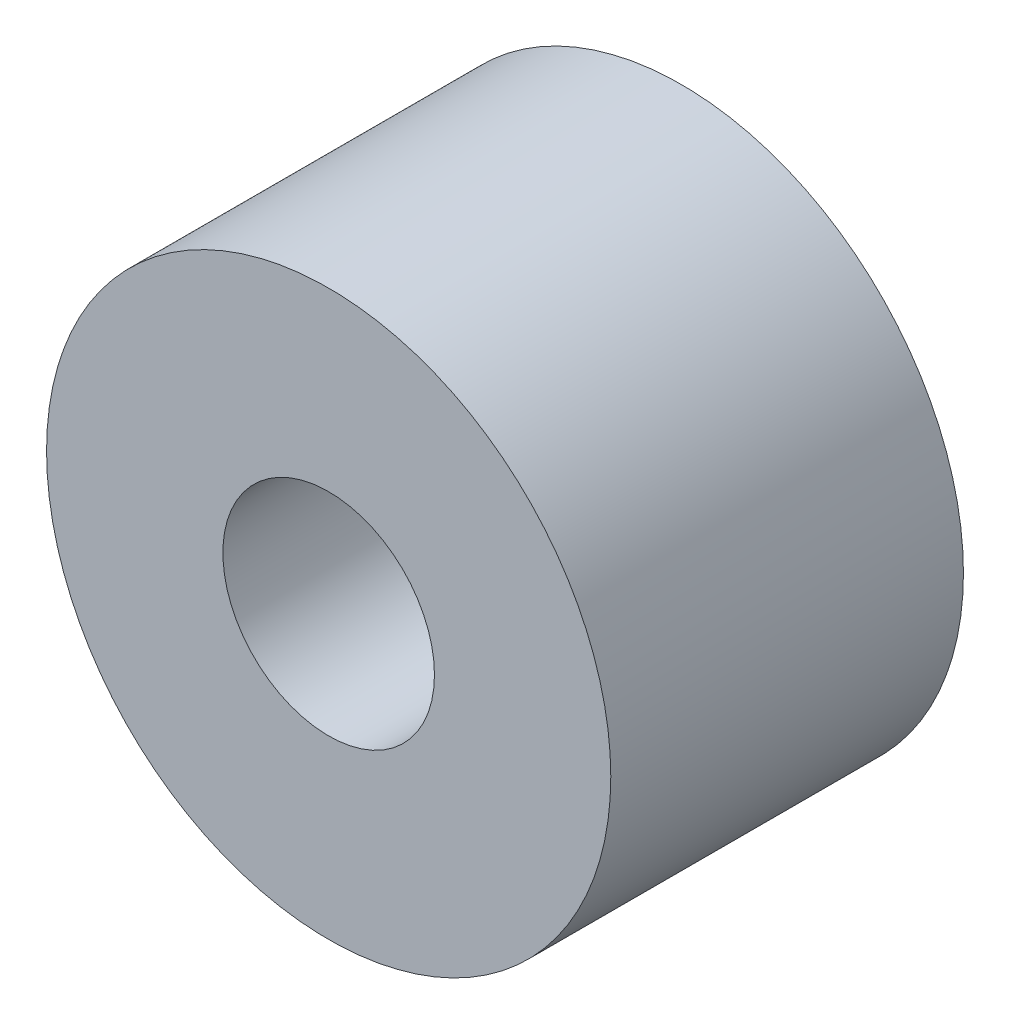
from build123d import *

# Parameters (mm, degrees)
SKETCH1_R           = 4
SKETCH1_R_2         = 1.5
BOSS_EXTRUDE1_DEPTH = 5


with BuildPart() as part:
    # Sketch1 → Boss-Extrude1 (new body)
    with BuildSketch(Plane.XY):
        Circle(SKETCH1_R)
        Circle(SKETCH1_R_2, mode=Mode.SUBTRACT)
    extrude(amount=BOSS_EXTRUDE1_DEPTH)


solid = part.part
